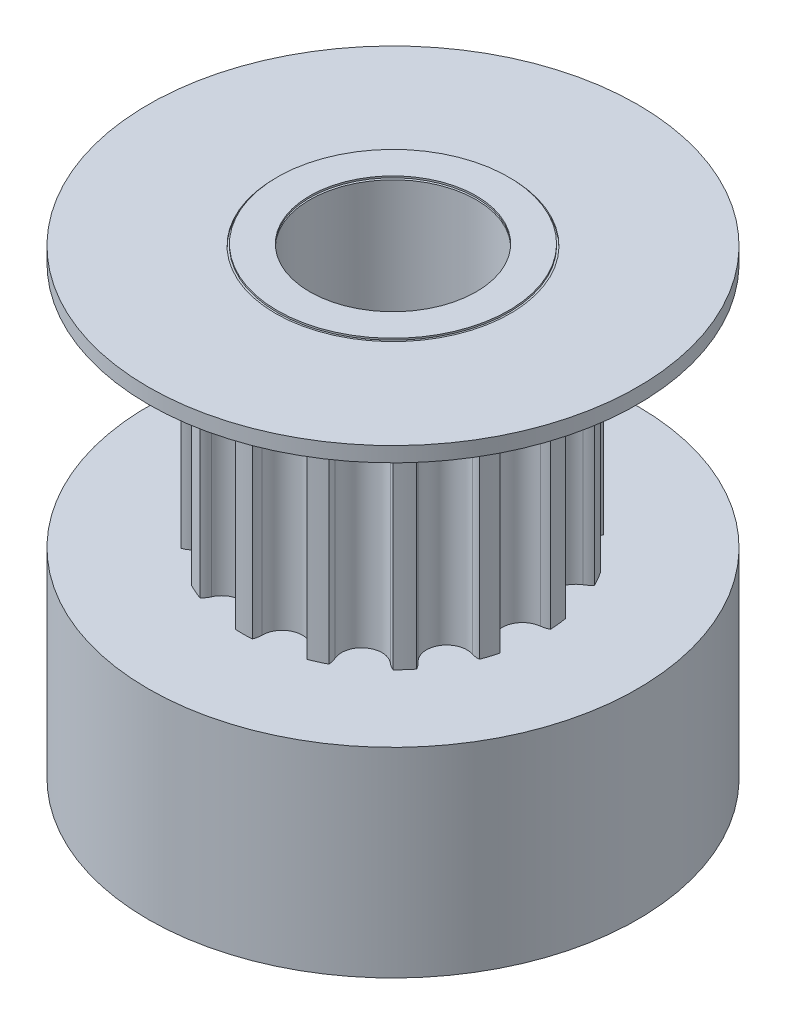
from build123d import *

# Parameters (mm, degrees)
BOSS_EXTRUDE1_DEPTH = 7.4
SKETCH2_R           = 7.35
BOSS_EXTRUDE2_DEPTH = 6
BOSS_EXTRUDE3_DEPTH = 1.5
CUT_EXTRUDE1_START  = -0.1
CUT_EXTRUDE1_DEPTH  = 0.1
CUT_EXTRUDE2_START  = -1.6
CUT_EXTRUDE2_DEPTH  = 1.6
CUT_EXTRUDE3_START  = -13.4
CUT_EXTRUDE3_DEPTH  = 13.4
CUT_EXTRUDE4_START  = -0.1
CUT_EXTRUDE4_DEPTH  = 0.1
BOSS_EXTRUDE4_START = 0.45
SKETCH8_R           = 7.35
BOSS_EXTRUDE4_DEPTH = 0.45
SKETCH9_R           = 3.5254
CUT_EXTRUDE5_DEPTH  = 0.0508
SKETCH13_R          = 2.5
CUT_EXTRUDE6_DEPTH  = 692.982195909


with BuildPart() as part:
    # Sketch1 → Boss-Extrude1 (new body)
    with BuildSketch(Plane.XZ.offset(-7.4)):
        with BuildLine():
            ThreePointArc((91.128150208, 677.751658944), (91.015370064, 677.800914334), (90.913687093, 677.870239853))
            ThreePointArc((90.913687093, 677.870239853), (90.984932811, 678.108661471), (91.069248689, 678.342780358))
            ThreePointArc((91.069248689, 678.342780358), (91.192228282, 678.338146361), (91.312212717, 678.310775031))
            ThreePointArc((91.312212717, 678.310775031), (92.029327433, 678.583047694), (91.912427908, 679.341150867))
            ThreePointArc((91.912427908, 679.341150867), (91.829432093, 679.432019722), (91.764737305, 679.536709925))
            ThreePointArc((91.764737305, 679.536709925), (91.926798315, 679.725540668), (92.099049433, 679.905124556))
            ThreePointArc((92.099049433, 679.905124556), (92.209512065, 679.850870882), (92.307990377, 679.777063862))
            ThreePointArc((92.307990377, 679.777063862), (93.073850539, 679.734120484), (93.275405848, 680.474229514))
            ThreePointArc((93.275405848, 680.474229514), (93.236545091, 680.590999784), (93.220024803, 680.712952784))
            ThreePointArc((93.220024803, 680.712952784), (93.444879286, 680.8195421), (93.67528186, 680.913539304))
            ThreePointArc((93.67528186, 680.913539304), (93.754127538, 680.819046906), (93.814071933, 680.7115661))
            ThreePointArc((93.814071933, 680.7115661), (94.496253359, 680.360831981), (94.981412759, 680.954975294))
            ThreePointArc((94.981412759, 680.954975294), (94.993406438, 681.077456337), (95.027917159, 681.195585353))
            ThreePointArc((95.027917159, 681.195585353), (95.27668573, 681.201502981), (95.525401062, 681.19366053))
            ThreePointArc((95.525401062, 681.19366053), (95.558996653, 681.075268003), (95.570042201, 680.952697819))
            ThreePointArc((95.570042201, 680.952697819), (96.050589526, 680.354818074), (96.735464548, 680.700262893))
            ThreePointArc((96.735464548, 680.700262893), (96.796238848, 680.807276625), (96.875813359, 680.901156076))
            ThreePointArc((96.875813359, 680.901156076), (97.105481674, 680.805378805), (97.329504623, 680.69705273))
            ThreePointArc((97.329504623, 680.69705273), (97.312041144, 680.575231217), (97.272277968, 680.458765153))
            ThreePointArc((97.272277968, 680.458765153), (97.468100194, 679.717118622), (98.234269726, 679.7541344))
            ThreePointArc((98.234269726, 679.7541344), (98.333316217, 679.827177174), (98.444195363, 679.880574451))
            ThreePointArc((98.444195363, 679.880574451), (98.615051683, 679.69966304), (98.775646647, 679.509583904))
            ThreePointArc((98.775646647, 679.509583904), (98.710143691, 679.405397451), (98.626447207, 679.315173548))
            ThreePointArc((98.626447207, 679.315173548), (98.503684891, 678.557997654), (99.218671261, 678.280184026))
            ThreePointArc((99.218671261, 678.280184026), (99.338863905, 678.306626083), (99.461875675, 678.310308312))
            ThreePointArc((99.461875675, 678.310308312), (99.54437739, 678.075543988), (99.61377604, 677.8365782))
            ThreePointArc((99.61377604, 677.8365782), (99.511559664, 677.768041591), (99.398401753, 677.719660382))
            ThreePointArc((99.398401753, 677.719660382), (98.978281617, 677.077877715), (99.518457184, 676.533271182))
            ThreePointArc((99.518457184, 676.533271182), (99.639013582, 676.50854045), (99.752888122, 676.461870939))
            ThreePointArc((99.752888122, 676.461870939), (99.732769937, 676.213846587), (99.698972616, 675.967313503))
            ThreePointArc((99.698972616, 675.967313503), (99.57771696, 675.946277341), (99.454663654, 675.948104375))
            ThreePointArc((99.454663654, 675.948104375), (98.809828284, 675.53268499), (99.081791786, 674.815452968))
            ThreePointArc((99.081791786, 674.815452968), (99.181866641, 674.743825616), (99.26691401, 674.654873947))
            ThreePointArc((99.26691401, 674.654873947), (99.147654541, 674.43647523), (99.016505113, 674.22500266))
            ThreePointArc((99.016505113, 674.22500266), (98.897176381, 674.255104288), (98.785504714, 674.306823656))
            ThreePointArc((98.785504714, 674.306823656), (98.027452004, 674.189597337), (97.984178482, 673.423755759))
            ThreePointArc((97.984178482, 673.423755759), (98.046467943, 673.317616806), (98.087982677, 673.201763533))
            ThreePointArc((98.087982677, 673.201763533), (97.890202969, 673.050753573), (97.684378362, 672.910907045))
            ThreePointArc((97.684378362, 672.910907045), (97.587609576, 672.986941619), (97.506628594, 673.079610571))
            ThreePointArc((97.506628594, 673.079610571), (96.766432745, 673.280846814), (96.415404583, 672.598816647))
            ThreePointArc((96.415404583, 672.598816647), (96.429138235, 672.476518482), (96.41994206, 672.353795687))
            ThreePointArc((96.41994206, 672.353795687), (96.177840023, 672.296285478), (95.93292918, 672.252245728))
            ThreePointArc((95.93292918, 672.252245728), (95.875452543, 672.361066178), (95.839164593, 672.478661412))
            ThreePointArc((95.839164593, 672.478661412), (95.244812192, 672.963564642), (94.646725348, 672.483275097))
            ThreePointArc((94.646725348, 672.483275097), (94.609528519, 672.365964185), (94.551211537, 672.257591754))
            ThreePointArc((94.551211537, 672.257591754), (94.306648812, 672.303525334), (94.064999043, 672.362907234))
            ThreePointArc((94.064999043, 672.362907234), (94.056752787, 672.485697517), (94.071432386, 672.607885747))
            ThreePointArc((94.071432386, 672.607885747), (93.725692361, 673.292611791), (92.983961485, 673.097109294))
            ThreePointArc((92.983961485, 673.097109294), (92.902265844, 673.005069757), (92.804911591, 672.929786268))
            ThreePointArc((92.804911591, 672.929786268), (92.600175295, 673.071221303), (92.403570041, 673.223757184))
            ThreePointArc((92.403570041, 673.223757184), (92.445980018, 673.339285743), (92.50908893, 673.444939515))
            ThreePointArc((92.50908893, 673.444939515), (92.471742874, 674.21109302), (91.714619971, 674.334181729))
            ThreePointArc((91.714619971, 674.334181729), (91.602551437, 674.283328038), (91.482993348, 674.25415069))
            ThreePointArc((91.482993348, 674.25415069), (91.353484246, 674.466631779), (91.235918342, 674.6859468))
            ThreePointArc((91.235918342, 674.6859468), (91.321651482, 674.774237699), (91.422277602, 674.845088516))
            ThreePointArc((91.422277602, 674.845088516), (91.699782987, 675.560194579), (91.058181486, 675.980591338))
            ThreePointArc((91.058181486, 675.980591338), (90.935117726, 675.979716559), (90.814028481, 676.001690381))
            ThreePointArc((90.814028481, 676.001690381), (90.782139874, 676.248477612), (90.763941532, 676.496650215))
            ThreePointArc((90.763941532, 676.496650215), (90.878173797, 676.542437155), (90.998917955, 676.566234267))
            ThreePointArc((90.998917955, 676.566234267), (91.543291578, 677.106644554), (91.128150208, 677.751658944))
        make_face()
    extrude(amount=BOSS_EXTRUDE1_DEPTH)

    # Sketch2 → Boss-Extrude2 (add)
    with BuildSketch(Plane(origin=(0, 0, 0), x_dir=(1, 0, 0), z_dir=(0, 1, 0))):
        with Locations(Location((95.259274839, -676.701536663, 0), (0, 0, 90))):
            Circle(SKETCH2_R)
    extrude(amount=-BOSS_EXTRUDE2_DEPTH)

    # Sketch3 → Boss-Extrude3 (add)
    with BuildSketch(Plane.XZ.offset(6)):
        with BuildLine():
            Line((96.041010843, 679.076171124), (96.626778532, 678.883334837))
            Line((96.626778532, 678.883334837), (96.602621135, 678.809953303))
            ThreePointArc((96.602621135, 678.809953303), (94.188428595, 674.442490776), (96.041010843, 679.076171124))
        make_face()
    extrude(amount=BOSS_EXTRUDE3_DEPTH)

    # Sketch4 → Cut-Extrude1 (cut)
    with BuildSketch(Plane.XZ.offset(6).offset(CUT_EXTRUDE1_START)):
        with BuildLine():
            Line((93.270250047, 678.216059815), (92.990087847, 678.30828996))
            Line((92.990087847, 678.30828996), (92.475234347, 676.744349121))
            Line((92.475234347, 676.744349121), (92.759792338, 676.650671871))
            ThreePointArc((92.759792338, 676.650671871), (92.882452531, 677.476595188), (93.270250047, 678.216059815))
        make_face()
    extrude(amount=CUT_EXTRUDE1_DEPTH, mode=Mode.SUBTRACT)

    # Sketch5 → Cut-Extrude2 (cut)
    with BuildSketch(Plane.XZ.offset(7.5).offset(CUT_EXTRUDE2_START)):
        with BuildLine():
            Line((96.602621135, 678.809953303), (96.626778532, 678.883334837))
            Line((96.626778532, 678.883334837), (96.041010843, 679.076171124))
            ThreePointArc((96.041010843, 679.076171124), (94.987937535, 679.186768256), (93.983539757, 678.851536663))
            Line((93.983539757, 678.851536663), (96.535009921, 678.851536663))
            ThreePointArc((96.535009921, 678.851536663), (96.568980573, 678.831013334), (96.602621135, 678.809953303))
        make_face()
    extrude(amount=CUT_EXTRUDE2_DEPTH, mode=Mode.SUBTRACT)

    # Sketch6 → Cut-Extrude3 (cut)
    with BuildSketch(Plane.XZ.offset(5.9).offset(CUT_EXTRUDE3_START)):
        with BuildLine():
            Line((93.983539757, 678.851536663), (96.535009921, 678.851536663))
            ThreePointArc((96.535009921, 678.851536663), (95.259274839, 679.201536663), (93.983539757, 678.851536663))
        make_face()
    extrude(amount=CUT_EXTRUDE3_DEPTH, mode=Mode.SUBTRACT)

    # Sketch7 → Cut-Extrude4 (cut)
    with BuildSketch(Plane.XZ.offset(6).offset(CUT_EXTRUDE4_START)):
        with BuildLine():
            Line((96.041010843, 679.076171124), (95.715643525, 679.183282914))
            Line((95.715643525, 679.183282914), (95.708270643, 679.160886734))
            ThreePointArc((95.708270643, 679.160886734), (95.876096839, 679.124248083), (96.041010843, 679.076171124))
        make_face()
    extrude(amount=CUT_EXTRUDE4_DEPTH, mode=Mode.SUBTRACT)

    # Sketch8 → Boss-Extrude4 (add)
    with BuildSketch(Plane(origin=(0, 7.4, 0), x_dir=(-1, 0, 0), z_dir=(0, 1, 0)).offset(BOSS_EXTRUDE4_START)):
        with Locations(Location((-95.259274839, 676.701536663, 0), (0, 0, 270))):
            Circle(SKETCH8_R)
    extrude(amount=-BOSS_EXTRUDE4_DEPTH)

    # Sketch9 → Cut-Extrude5 (cut)
    with BuildSketch(Plane(origin=(0, 7.85, 0), x_dir=(1, 0, 0), z_dir=(0, 1, 0))):
        with Locations(Location((95.259274839, -676.701536663, 0), (0, 0, 270))):
            Circle(SKETCH9_R)
    extrude(amount=-CUT_EXTRUDE5_DEPTH, mode=Mode.SUBTRACT)


with BuildPart() as body_2:
    # Sketch10 → Revolve1 (revolve)
    with BuildSketch(Plane(origin=(0, 0, 676.701536663), x_dir=(-1, 0, 0), z_dir=(0, 0, -1)), mode=Mode.PRIVATE) as revolve1_sk:
        Polygon((-98.733874839, 7.85), (-95.259274839, 7.85), (-95.259274839, 12.1008), (-97.759274839, 12.1008), (-97.759274839, 7.9008), (-98.733874839, 7.9008), align=None)
    revolve(revolve1_sk.sketch.rotate(Axis((95.259274839, 7.85, 676.701536663), (0, 1, 0)), 270), axis=Axis((95.259274839, 7.85, 676.701536663), (0, 1, 0)))


with BuildPart() as cut_extrude6_tool:
    # Sketch13 → Cut-Extrude6 (new, through all)
    with BuildSketch(Plane.XZ.offset(7.5)):
        with Locations(Location((95.259274839, 676.701536663, 0), (0, 0, 270))):
            Circle(SKETCH13_R)
    extrude(amount=-CUT_EXTRUDE6_DEPTH)


with BuildPart() as part_1:
    add(part.part)

    # Cut-Extrude6: cut by cut_extrude6_tool
    add(cut_extrude6_tool.part, mode=Mode.SUBTRACT)


with BuildPart() as body_2_1:
    add(body_2.part)

    # Cut-Extrude6: cut by cut_extrude6_tool
    add(cut_extrude6_tool.part, mode=Mode.SUBTRACT)


solid = Compound([part_1.part, body_2_1.part])
